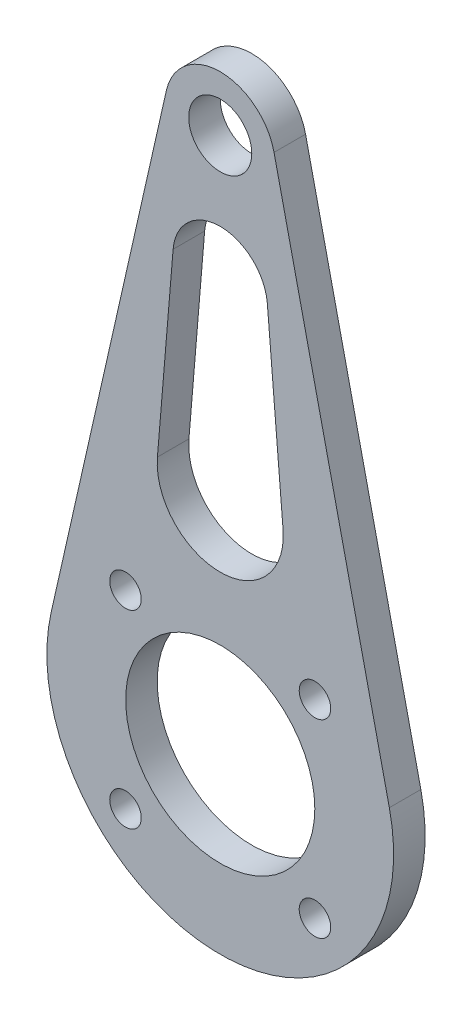
from build123d import *

# Parameters (mm, degrees)
SKETCH_1_R               = 6
SKETCH_1_R_2             = 2
EXTRUDE_1_DEPTH          = 2
SKETCH_2_R               = 1
CUT_EXTRUDE_8_DEPTH      = 40.131189606
PATTERN_CIRCULAR_2_COUNT = 4


with BuildPart() as part:
    # 草图1 → 凸台-拉伸1 (new body)
    with BuildSketch(Plane.XY):
        with BuildLine():
            Line((-3.413784582, 34.772058824), (-10.729037258, 2.426470588))
            ThreePointArc((-10.729037258, 2.426470588), (0, -11), (10.729037258, 2.426470588))
            Line((10.729037258, 2.426470588), (3.413784582, 34.772058824))
            ThreePointArc((3.413784582, 34.772058824), (0, 37.5), (-3.413784582, 34.772058824))
        make_face()
        Circle(SKETCH_1_R, mode=Mode.SUBTRACT)
        with Locations((0, 34)):
            Circle(SKETCH_1_R_2, mode=Mode.SUBTRACT)
        with BuildLine():
            Line((-2.989565186, 26.25), (-3.986086914, 14.333333333))
            ThreePointArc((-3.986086914, 14.333333333), (0, 10), (3.986086914, 14.333333333))
            Line((3.986086914, 14.333333333), (2.989565186, 26.25))
            ThreePointArc((2.989565186, 26.25), (0, 29), (-2.989565186, 26.25))
        make_face(mode=Mode.SUBTRACT)
    extrude(amount=EXTRUDE_1_DEPTH)

    # 草图2 → 切除-拉伸8 (cut, through all)
    with BuildSketch(Plane.XY):
        with Locations((6.01040764, -6.01040764)):
            Circle(SKETCH_2_R)
    cut_extrude_8 = extrude(amount=CUT_EXTRUDE_8_DEPTH, mode=Mode.SUBTRACT)

    # 阵列(圆周)2: 切除-拉伸8 ×4 about axis
    pattern_circular_2_axis = Axis((0, 0, 0), (0, 0, 1))
    for i in range(1, PATTERN_CIRCULAR_2_COUNT):
        add(cut_extrude_8.rotate(pattern_circular_2_axis, i * 360 / PATTERN_CIRCULAR_2_COUNT), mode=Mode.SUBTRACT)


solid = part.part
